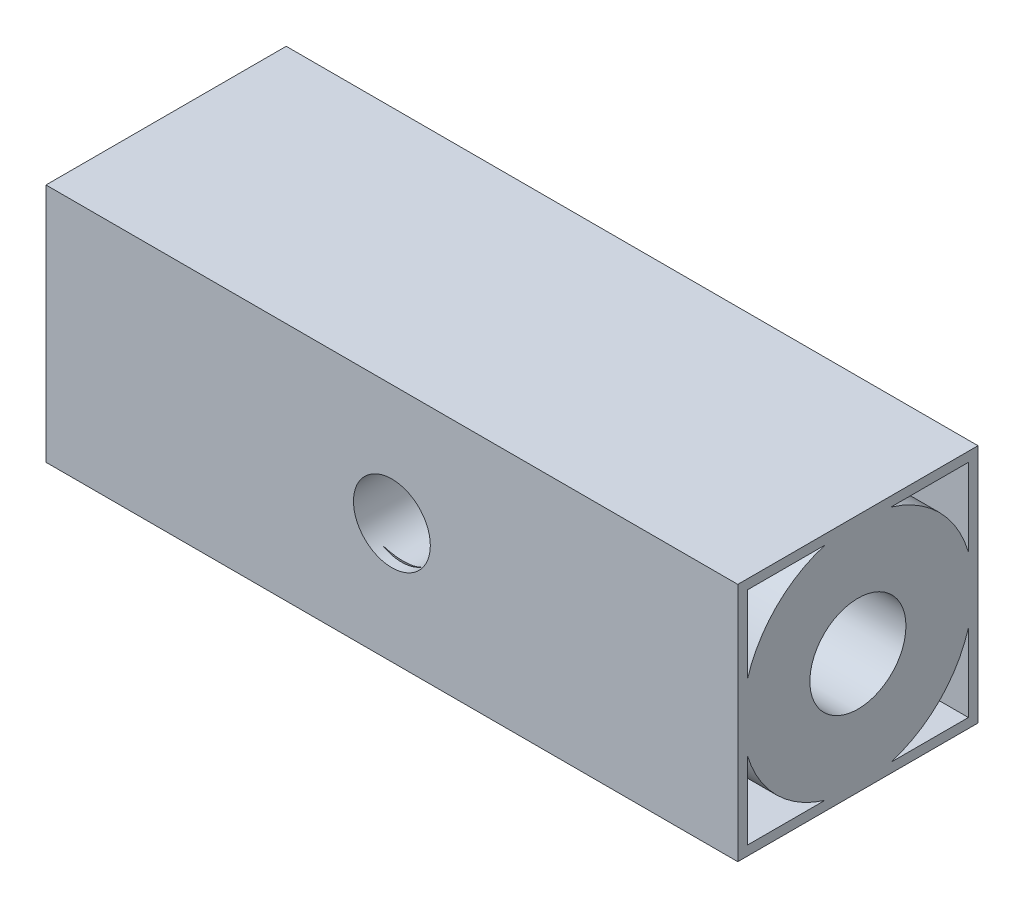
from build123d import *

# Parameters (mm, degrees)
SKETCH1_W           = 25
SKETCH1_H           = 25
SKETCH1_R           = 5
BOSS_EXTRUDE1_DEPTH = 72
SKETCH2_R           = 4
CUT_EXTRUDE1_DEPTH  = 78.235030912


with BuildPart() as part:
    # Sketch1 → Boss-Extrude1 (new body)
    with BuildSketch(Plane(origin=(0, 0, 0), x_dir=(0, 0, -1), z_dir=(1, 0, 0))):
        Rectangle(SKETCH1_W, SKETCH1_H)
        Circle(SKETCH1_R, mode=Mode.SUBTRACT)
        with BuildLine():
            Line((-11.5, -11.5), (-3.4278273, -11.5))
            ThreePointArc((-3.4278273, -11.5), (-8.485281374, -8.485281374), (-11.5, -3.4278273))
            Line((-11.5, -3.4278273), (-11.5, -11.5))
        make_face(mode=Mode.SUBTRACT)
        with BuildLine():
            Line((-11.5, 11.5), (-3.4278273, 11.5))
            ThreePointArc((-3.4278273, 11.5), (-8.485281374, 8.485281374), (-11.5, 3.4278273))
            Line((-11.5, 3.4278273), (-11.5, 11.5))
        make_face(mode=Mode.SUBTRACT)
        with BuildLine():
            Line((11.5, -11.5), (11.5, -3.4278273))
            ThreePointArc((11.5, -3.4278273), (8.485281374, -8.485281374), (3.4278273, -11.5))
            Line((3.4278273, -11.5), (11.5, -11.5))
        make_face(mode=Mode.SUBTRACT)
        with BuildLine():
            Line((3.4278273, 11.5), (11.5, 11.5))
            Line((11.5, 11.5), (11.5, 3.4278273))
            ThreePointArc((11.5, 3.4278273), (8.485281374, 8.485281374), (3.4278273, 11.5))
        make_face(mode=Mode.SUBTRACT)
    extrude(amount=BOSS_EXTRUDE1_DEPTH)

    # Sketch2 → Cut-Extrude1 (cut, through all)
    with BuildSketch(Plane.XY.offset(12.5)):
        with Locations((36, 0)):
            Circle(SKETCH2_R)
    extrude(amount=-CUT_EXTRUDE1_DEPTH, mode=Mode.SUBTRACT)


solid = part.part
